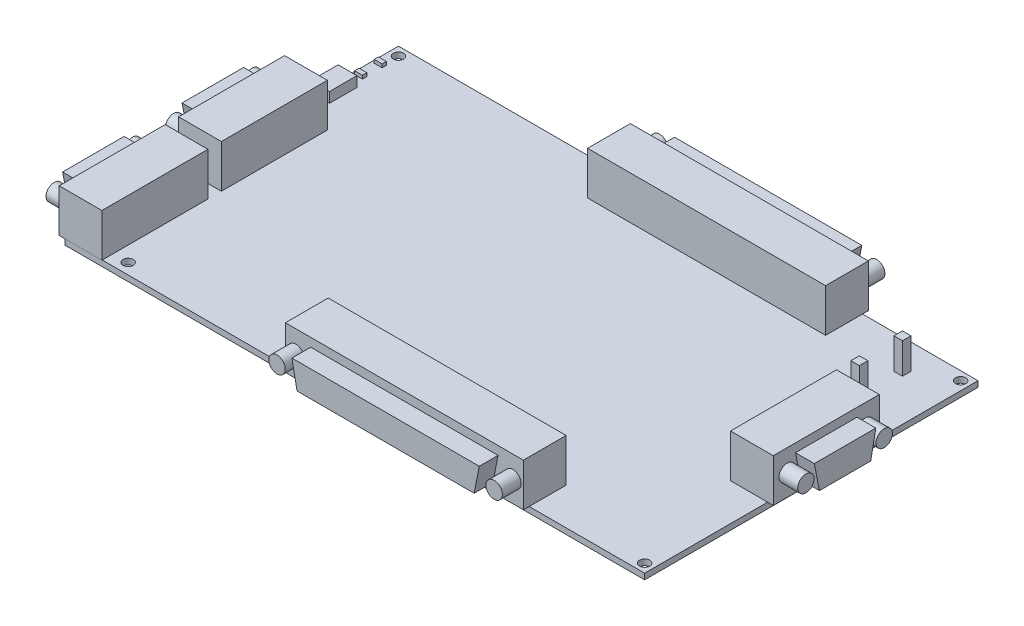
from build123d import *

# Parameters (mm, degrees)
SKETCH1_W           = 169.5
SKETCH1_H           = 97.5
BASE_DEPTH          = 1.7
MOUNTHOLES_REACH    = 99.786
SKETCH2_R           = 1.5
SKETCH3_W           = 12.51
SKETCH3_H           = 31
SKETCH3_W_2         = 69.6
SKETCH3_H_2         = 12.51
DSUBMAIN_DEPTH      = 12.6
SKETCH4_R           = 2.4
BOSS_EXTRUDE3_DEPTH = 5.5
SKETCH5_R           = 2.4
BOSS_EXTRUDE4_DEPTH = 5.5
SKETCH6_R           = 2.4
BOSS_EXTRUDE5_DEPTH = 5.5
BOSS_EXTRUDE6_START = 5.5
SKETCH7_R           = 2.4
BOSS_EXTRUDE6_DEPTH = 5.5
SKETCH8_W           = 5.5
SKETCH8_H           = 8
USB_DEPTH           = 3
SKETCH9_W           = 2.3
SKETCH9_H           = 1.26
LED_DEPTH           = 1
SKETCH10_W          = 2.5
SKETCH10_H          = 2.5
BOSS_EXTRUDE9_DEPTH = 9


with BuildPart() as part:
    # Sketch1 → Base (new body)
    with BuildSketch(Plane(origin=(0, 0, 0), x_dir=(1, 0, 0), z_dir=(0, 1, 0))):
        Rectangle(SKETCH1_W, SKETCH1_H)
    extrude(amount=BASE_DEPTH)

    # Sketch2 → MountHoles (cut, up to next)
    with BuildSketch(Plane(origin=(0, 1.7, 0), x_dir=(1, 0, 0), z_dir=(0, 1, 0)), mode=Mode.PRIVATE) as mountholes_sk1:
        with Locations((82.21, 46.21)):
            Circle(SKETCH2_R)
    mountholes_tool1 = extrude(mountholes_sk1.sketch, amount=-MOUNTHOLES_REACH, mode=Mode.PRIVATE) & part.part
    # Sketch2 → MountHoles (cut, up to next)
    with BuildSketch(Plane(origin=(0, 1.7, 0), x_dir=(1, 0, 0), z_dir=(0, 1, 0)), mode=Mode.PRIVATE) as mountholes_sk2:
        with Locations((82.21, -46.21)):
            Circle(SKETCH2_R)
    mountholes_tool2 = extrude(mountholes_sk2.sketch, amount=-MOUNTHOLES_REACH, mode=Mode.PRIVATE) & part.part
    # Sketch2 → MountHoles (cut, up to next)
    with BuildSketch(Plane(origin=(0, 1.7, 0), x_dir=(1, 0, 0), z_dir=(0, 1, 0)), mode=Mode.PRIVATE) as mountholes_sk3:
        with Locations((-69.51, -45.57)):
            Circle(SKETCH2_R)
    mountholes_tool3 = extrude(mountholes_sk3.sketch, amount=-MOUNTHOLES_REACH, mode=Mode.PRIVATE) & part.part
    # Sketch2 → MountHoles (cut, up to next)
    with BuildSketch(Plane(origin=(0, 1.7, 0), x_dir=(1, 0, 0), z_dir=(0, 1, 0)), mode=Mode.PRIVATE) as mountholes_sk4:
        with Locations((-82.21, 46.21)):
            Circle(SKETCH2_R)
    mountholes_tool4 = extrude(mountholes_sk4.sketch, amount=-MOUNTHOLES_REACH, mode=Mode.PRIVATE) & part.part
    add(mountholes_tool1.solids().sort_by_distance((82.21, 1.7, -46.21))[0], mode=Mode.SUBTRACT)
    add(mountholes_tool2.solids().sort_by_distance((82.21, 1.7, 46.21))[0], mode=Mode.SUBTRACT)
    add(mountholes_tool3.solids().sort_by_distance((-69.51, 1.7, 45.57))[0], mode=Mode.SUBTRACT)
    add(mountholes_tool4.solids().sort_by_distance((-82.21, 1.7, -46.21))[0], mode=Mode.SUBTRACT)

    # Sketch3 → DSUBMain (add)
    with BuildSketch(Plane(origin=(0, 1.7, 0), x_dir=(1, 0, 0), z_dir=(0, 1, 0))):
        with Locations((-80.145, 1.59)):
            Rectangle(SKETCH3_W, SKETCH3_H)
        with Locations((-80.145, -33.35)):
            Rectangle(SKETCH3_W, SKETCH3_H)
        with Locations((80.145, 2.72)):
            Rectangle(SKETCH3_W, SKETCH3_H)
        with Locations((16.18, 44.195)):
            Rectangle(SKETCH3_W_2, SKETCH3_H_2)
        with Locations((16.18, -44.195)):
            Rectangle(SKETCH3_W_2, SKETCH3_H_2)
    extrude(amount=DSUBMAIN_DEPTH)

    # Sketch4 → Boss-Extrude3 (add)
    with BuildSketch(Plane(origin=(86.4, 0, 0), x_dir=(0, 0, -1), z_dir=(1, 0, 0))):
        with Locations((-8.73, 8)):
            Circle(SKETCH4_R)
        with Locations((14.17, 8)):
            Circle(SKETCH4_R)
        Polygon((-6.28, 11.8), (11.72, 11.8), (10.22, 4.2), (-4.78, 4.2), align=None)
    extrude(amount=BOSS_EXTRUDE3_DEPTH)

    # Sketch5 → Boss-Extrude4 (add)
    with BuildSketch(Plane.ZY.offset(86.4)):
        with Locations((-13.04, 8)):
            Circle(SKETCH5_R)
        with Locations((9.86, 8)):
            Circle(SKETCH5_R)
        with Locations((21.9, 8)):
            Circle(SKETCH5_R)
        with Locations((44.8, 8)):
            Circle(SKETCH5_R)
        Polygon((-10.59, 11.8), (7.41, 11.8), (5.91, 4.2), (-9.09, 4.2), align=None)
        Polygon((24.35, 11.8), (42.35, 11.8), (40.85, 4.2), (25.85, 4.2), align=None)
    extrude(amount=BOSS_EXTRUDE4_DEPTH)

    # Sketch6 → Boss-Extrude5 (add)
    with BuildSketch(Plane.XY.offset(50.45)):
        with Locations((-15.57, 8)):
            Circle(SKETCH6_R)
        with Locations((47.93, 8)):
            Circle(SKETCH6_R)
        Polygon((-11.22, 11.8), (43.58, 11.8), (42.08, 4.2), (-9.72, 4.2), align=None)
    extrude(amount=BOSS_EXTRUDE5_DEPTH)

    # Sketch7 → Boss-Extrude6 (add)
    with BuildSketch(Plane(origin=(0, 0, -50.45), x_dir=(-1, 0, 0), z_dir=(0, 0, -1)).offset(BOSS_EXTRUDE6_START)):
        with Locations((-47.93, 8)):
            Circle(SKETCH7_R)
        with Locations((15.57, 8)):
            Circle(SKETCH7_R)
        Polygon((11.22, 11.8), (-43.58, 11.8), (-42.08, 4.2), (9.72, 4.2), align=None)
    extrude(amount=-BOSS_EXTRUDE6_DEPTH)

    # Sketch8 → USB (add)
    with BuildSketch(Plane(origin=(0, 1.7, 0), x_dir=(1, 0, 0), z_dir=(0, 1, 0))):
        with Locations((-83.1, 28.19)):
            Rectangle(SKETCH8_W, SKETCH8_H)
    extrude(amount=USB_DEPTH)

    # Sketch9 → LED (add)
    with BuildSketch(Plane(origin=(0, 1.7, 0), x_dir=(1, 0, 0), z_dir=(0, 1, 0))):
        with Locations((-82.8, 41.47)):
            Rectangle(SKETCH9_W, SKETCH9_H)
        with Locations((-82.8, 35.75)):
            Rectangle(SKETCH9_W, SKETCH9_H)
        with Locations((-82.8, 22.57)):
            Rectangle(SKETCH9_W, SKETCH9_H)
        with Locations((-82.8, 20.03)):
            Rectangle(SKETCH9_W, SKETCH9_H)
    extrude(amount=LED_DEPTH)

    # Sketch10 → Boss-Extrude9 (add)
    with BuildSketch(Plane(origin=(0, 1.7, 0), x_dir=(1, 0, 0), z_dir=(0, 1, 0))):
        with Locations((71.33, 40.08)):
            Rectangle(SKETCH10_W, SKETCH10_H)
        with Locations((71.33, 27.47)):
            Rectangle(SKETCH10_W, SKETCH10_H)
    extrude(amount=BOSS_EXTRUDE9_DEPTH)


solid = part.part
